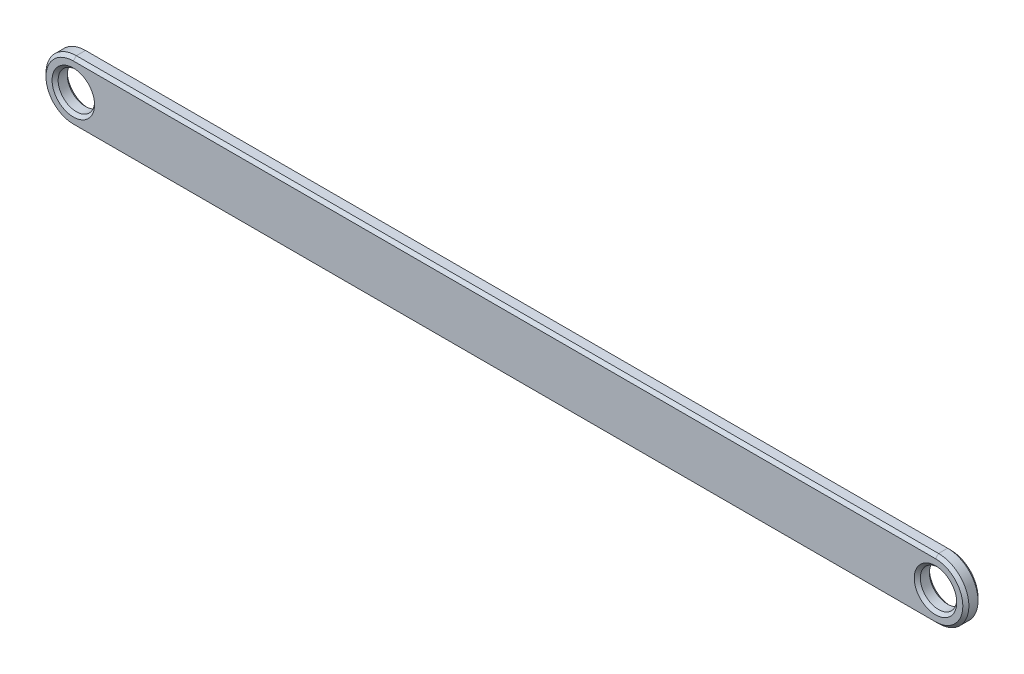
from build123d import *

# Parameters (mm, degrees)
SKETCH1_R           = 30
BOSS_EXTRUDE1_DEPTH = 25
CHAMFER1_SIZE       = 5


with BuildPart() as part:
    # Sketch1 → Boss-Extrude1 (new body)
    with BuildSketch(Plane.XY):
        with BuildLine():
            Line((710, -50), (-710, -50))
            ThreePointArc((-710, -50), (-760, 0), (-710, 50))
            Line((-710, 50), (710, 50))
            ThreePointArc((710, 50), (760, 0), (710, -50))
        make_face()
        with Locations((-710, 0)):
            Circle(SKETCH1_R, mode=Mode.SUBTRACT)
        with Locations(Location((710, 0, 0), (0, 0, 180))):
            Circle(SKETCH1_R, mode=Mode.SUBTRACT)
    extrude(amount=BOSS_EXTRUDE1_DEPTH)

    # Chamfer1
    chamfer1_edges = [part.edges().sort_by_distance(p)[0] for p in [
        (760, 0, 25),
        (-740, 0, 0),
        (-740, 0, 25),
        (0, 50, 25),
        (740, 0, 0),
        (740, 0, 25),
        (-760, 0, 25),
        (0, 50, 0),
        (760, 0, 0),
        (0, -50, 0),
        (-760, 0, 0),
        (0, -50, 25),
    ]]
    chamfer(chamfer1_edges, length=CHAMFER1_SIZE)


solid = part.part
